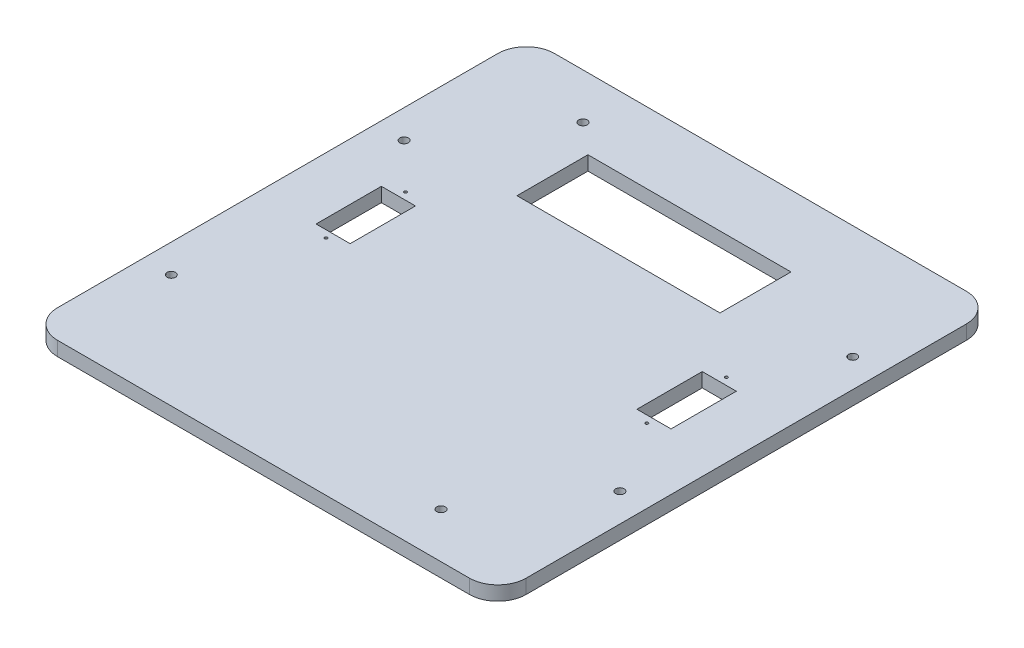
from build123d import *

# Parameters (mm, degrees)
RESSALTO_EXTRUS_O1_DEPTH = 5
ESBO_O2_R                = 1.5
CORTE_EXTRUS_O1_DEPTH    = 5
ESBO_O4_R                = 0.5
ESBO_O4_W                = 12
ESBO_O4_H                = 23
CORTE_EXTRUS_O3_DEPTH    = 193.467750623
ESBO_O5_R                = 1.5
ESBO_O5_W                = 71.5
ESBO_O5_H                = 25
CORTE_EXTRUS_O4_DEPTH    = 193.467750623


with BuildPart() as part:
    # Esboço1 → Ressalto-extrusão1 (new body)
    with BuildSketch(Plane(origin=(0, 0, 0), x_dir=(1, 0, 0), z_dir=(0, 1, 0))):
        with BuildLine():
            Line((-25.463589741, 142.264378701), (119.536410259, 142.264378701))
            ThreePointArc((119.536410259, 142.264378701), (126.607478071, 139.335446513), (129.536410259, 132.264378701))
            Line((129.536410259, 132.264378701), (129.536410259, -22.735621299))
            ThreePointArc((129.536410259, -22.735621299), (126.607478071, -29.806689111), (119.536410259, -32.735621299))
            Line((119.536410259, -32.735621299), (-25.463589741, -32.735621299))
            ThreePointArc((-25.463589741, -32.735621299), (-32.534657553, -29.806689111), (-35.463589741, -22.735621299))
            Line((-35.463589741, -22.735621299), (-35.463589741, 132.264378701))
            ThreePointArc((-35.463589741, 132.264378701), (-32.534657553, 139.335446513), (-25.463589741, 142.264378701))
        make_face()
    extrude(amount=RESSALTO_EXTRUS_O1_DEPTH)

    # Esboço2 → Corte-extrusão1 (cut)
    with BuildSketch(Plane(origin=(0, 5, 0), x_dir=(1, 0, 0), z_dir=(0, 1, 0))):
        with Locations(Location((-25.463589741, 7.264378701, 0), (0, 0, 270))):
            Circle(ESBO_O2_R)
        with Locations(Location((0.536410259, 126.264378701, 0), (0, 0, 270))):
            Circle(ESBO_O2_R)
        with Locations(Location((119.536410259, 102.264378701, 0), (0, 0, 270))):
            Circle(ESBO_O2_R)
        with Locations(Location((93.536410259, -16.735621299, 0), (0, 0, 270))):
            Circle(ESBO_O2_R)
    extrude(amount=-CORTE_EXTRUS_O1_DEPTH, mode=Mode.SUBTRACT)

    # Esboço4 → Corte-extrusão3 (cut, through all)
    with BuildSketch(Plane(origin=(0, 5, 0), x_dir=(1, 0, 0), z_dir=(0, 1, 0))):
        with Locations(Location((-9.463589741, 45.764378701, 0), (0, 0, 270))):
            Circle(ESBO_O4_R)
        with Locations(Location((-9.463589741, 73.764378701, 0), (0, 0, 270))):
            Circle(ESBO_O4_R)
        with Locations(Location((103.536410259, 45.764378701, 0), (0, 0, 270))):
            Circle(ESBO_O4_R)
        with Locations(Location((103.536410259, 73.764378701, 0), (0, 0, 270))):
            Circle(ESBO_O4_R)
        with Locations((-9.463589741, 59.764378701)):
            Rectangle(ESBO_O4_W, ESBO_O4_H)
        with Locations((103.536410259, 59.764378701)):
            Rectangle(ESBO_O4_W, ESBO_O4_H)
    extrude(amount=-CORTE_EXTRUS_O3_DEPTH, mode=Mode.SUBTRACT)

    # Esboço5 → Corte-extrusão4 (cut, through all)
    with BuildSketch(Plane(origin=(0, 5, 0), x_dir=(1, 0, 0), z_dir=(0, 1, 0))):
        with Locations(Location((-25.463589741, 89.264378701, 0), (0, 0, 270))):
            Circle(ESBO_O5_R)
        with Locations(Location((119.536410259, 20.264378701, 0), (0, 0, 270))):
            Circle(ESBO_O5_R)
        with Locations((47.036410259, 104.764378701)):
            Rectangle(ESBO_O5_W, ESBO_O5_H)
    extrude(amount=-CORTE_EXTRUS_O4_DEPTH, mode=Mode.SUBTRACT)


solid = part.part
